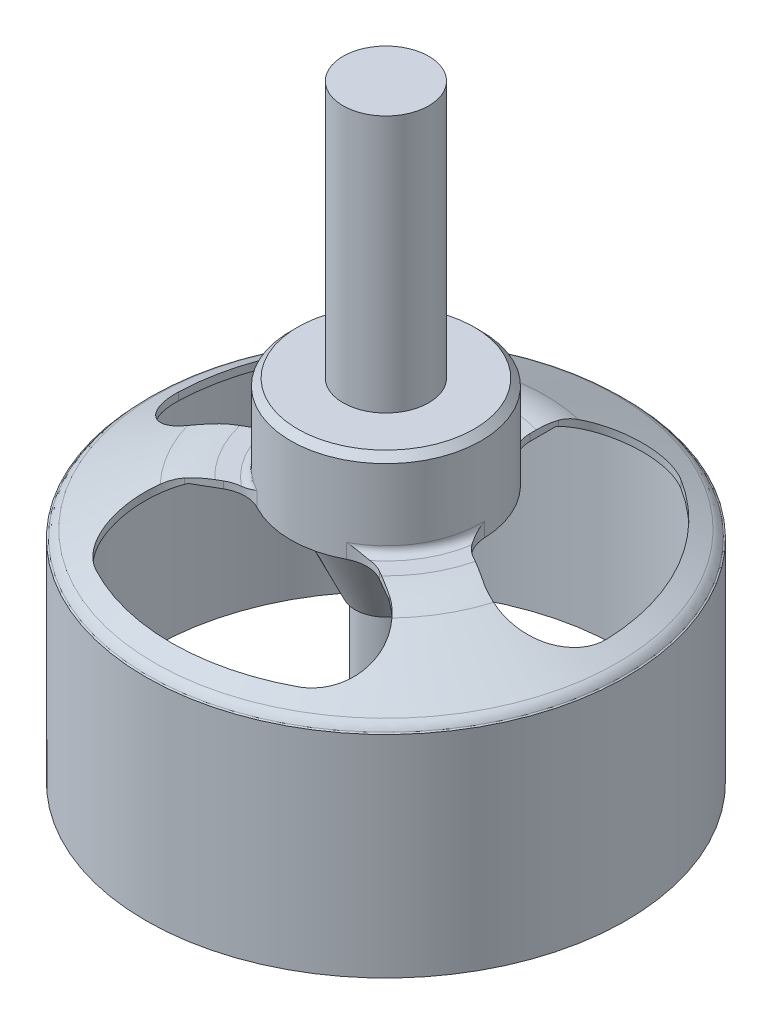
from build123d import *

# Parameters (mm, degrees)
FILLET2_R           = 1
FILLET3_R           = 5
FILLET4_R           = 0.45
CHAMFER1_SIZE       = 0.4
BOSS_EXTRUDE1_START = -12.3
BOSS_EXTRUDE1_DEPTH = 12.3
SKETCH5_R           = 1.5
BOSS_EXTRUDE2_DEPTH = 15
CUT_EXTRUDE1_START  = -15
CUT_EXTRUDE1_DEPTH  = 15


with BuildPart() as part:
    # Sketch1 → Revolve1 (revolve)
    with BuildSketch(Plane.XY, mode=Mode.PRIVATE) as revolve1_sk:
        with BuildLine():
            Line((-14, 20.3), (-14, 8))
            Line((-14, 8), (-13.6, 8))
            Line((-13.6, 8), (-13.6, 20.253745072))
            Line((-13.6, 20.253745072), (-8.154839366, 23))
            Line((-8.154839366, 23), (-4.318061354, 23))
            Line((-4.318061354, 23), (-1.8, 17.6))
            Line((-1.8, 17.6), (0, 17.6))
            Line((0, 17.6), (0, 43.4))
            Line((0, 43.4), (-2.5, 43.4))
            Line((-2.5, 43.4), (-2.5, 28.4))
            Line((-2.5, 28.4), (-5.55, 28.4))
            Line((-5.55, 28.4), (-5.55, 23.4))
            Line((-5.55, 23.4), (-8.25, 23.4))
            Line((-8.25, 23.4), (-14, 20.5))
            ThreePointArc((-14, 20.5), (-13.9, 20.4), (-14, 20.3))
        make_face()
    revolve(revolve1_sk.sketch.rotate(Axis((0, 0, 0), (0, 1, 0)), 180), axis=Axis((0, 0, 0), (0, 1, 0)))

    # Fillet2
    fillet2_edges = [part.edges().sort_by_distance(p)[0] for p in [
        (-14, 20.5, 0),
    ]]
    fillet(fillet2_edges, radius=FILLET2_R)

    # Fillet3
    fillet3_edges = [part.edges().sort_by_distance(p)[0] for p in [
        (-8.25, 23.4, 0),
    ]]
    fillet(fillet3_edges, radius=FILLET3_R)

    # Fillet4
    fillet4_edges = [part.edges().sort_by_distance(p)[0] for p in [
        (-5.55, 23.4, 0),
    ]]
    fillet(fillet4_edges, radius=FILLET4_R)

    # Chamfer1
    chamfer1_edges = [part.edges().sort_by_distance(p)[0] for p in [
        (-5.55, 28.4, 0),
    ]]
    chamfer(chamfer1_edges, length=CHAMFER1_SIZE)

    # Sketch4 → Boss-Extrude1 (add)
    with BuildSketch(Plane(origin=(0, 20.3, 0), x_dir=(1, 0, 0), z_dir=(0, 1, 0)).offset(BOSS_EXTRUDE1_START)):
        with BuildLine():
            ThreePointArc((-8.030070109, 11.46812862), (-4.209881193, 13.35203731), (0, 14))
            ThreePointArc((0, 14), (4.209881193, 13.35203731), (8.030070109, 11.46812862))
            Line((8.030070109, 11.46812862), (8.035805873, 11.47632014))
            ThreePointArc((8.035805873, 11.47632014), (0, 14.01), (-8.035805873, 11.47632014))
            Line((-8.035805873, 11.47632014), (-8.030070109, 11.46812862))
        make_face()
    extrude(amount=BOSS_EXTRUDE1_DEPTH)

    # Sketch5 → Boss-Extrude2 (add)
    with BuildSketch(Plane.XZ.offset(-17.6)):
        with Locations(Location((0, 0, 0), (0, 0, 180))):
            Circle(SKETCH5_R)
    extrude(amount=BOSS_EXTRUDE2_DEPTH)

    # Sketch6 → Cut-Extrude1 (cut)
    with BuildSketch(Plane(origin=(0, 28.4, 0), x_dir=(1, 0, 0), z_dir=(0, 1, 0)).offset(CUT_EXTRUDE1_START)):
        with BuildLine():
            ThreePointArc((-5.546645972, 0.192920859), (-5.831031092, -0.767515055), (-6.545437314, -1.469608918))
            Line((-6.545437314, -1.469608918), (-7.984705657, -2.300570884))
            ThreePointArc((-7.984705657, -2.300570884), (-11.025253012, -2.276735113), (-12.483230926, 0.391559616))
            ThreePointArc((-12.483230926, 0.391559616), (-10.816112054, 6.244685206), (-6.580716038, 10.615015295))
            ThreePointArc((-6.580716038, 10.615015295), (-3.54091606, 10.686516748), (-2, 8.065243383))
            Line((-2, 8.065243383), (-2, 6.403319452))
            ThreePointArc((-2, 6.403319452), (-2.25082801, 5.433578584), (-2.940397351, 4.707075888))
            ThreePointArc((-2.940397351, 4.707075888), (-4.806440991, 2.775), (-5.546645972, 0.192920859))
        make_face()
        with BuildLine():
            ThreePointArc((5.546645972, 0.192920859), (4.806440991, 2.775), (2.940397351, 4.707075888))
            ThreePointArc((2.940397351, 4.707075888), (2.25082801, 5.433578584), (2, 6.403319452))
            Line((2, 6.403319452), (2, 8.065243383))
            ThreePointArc((2, 8.065243383), (3.54091606, 10.686516748), (6.580716038, 10.615015295))
            ThreePointArc((6.580716038, 10.615015295), (10.816112054, 6.244685206), (12.483230926, 0.391559616))
            ThreePointArc((12.483230926, 0.391559616), (11.025253012, -2.276735113), (7.984705657, -2.300570884))
            Line((7.984705657, -2.300570884), (6.545437314, -1.469608918))
            ThreePointArc((6.545437314, -1.469608918), (5.831031092, -0.767515055), (5.546645972, 0.192920859))
        make_face()
        with BuildLine():
            ThreePointArc((2.606248621, -4.899996747), (3.580203082, -4.666063528), (4.545437314, -4.933710533))
            Line((4.545437314, -4.933710533), (5.984705657, -5.764672499))
            ThreePointArc((5.984705657, -5.764672499), (7.484336952, -8.409781635), (5.902514888, -11.006574912))
            ThreePointArc((5.902514888, -11.006574912), (0, -12.489370412), (-5.902514888, -11.006574912))
            ThreePointArc((-5.902514888, -11.006574912), (-7.484336952, -8.409781635), (-5.984705657, -5.764672499))
            Line((-5.984705657, -5.764672499), (-4.545437314, -4.933710533))
            ThreePointArc((-4.545437314, -4.933710533), (-3.580203082, -4.666063528), (-2.606248621, -4.899996747))
            ThreePointArc((-2.606248621, -4.899996747), (0, -5.55), (2.606248621, -4.899996747))
        make_face()
    extrude(amount=CUT_EXTRUDE1_DEPTH, mode=Mode.SUBTRACT)


solid = part.part
